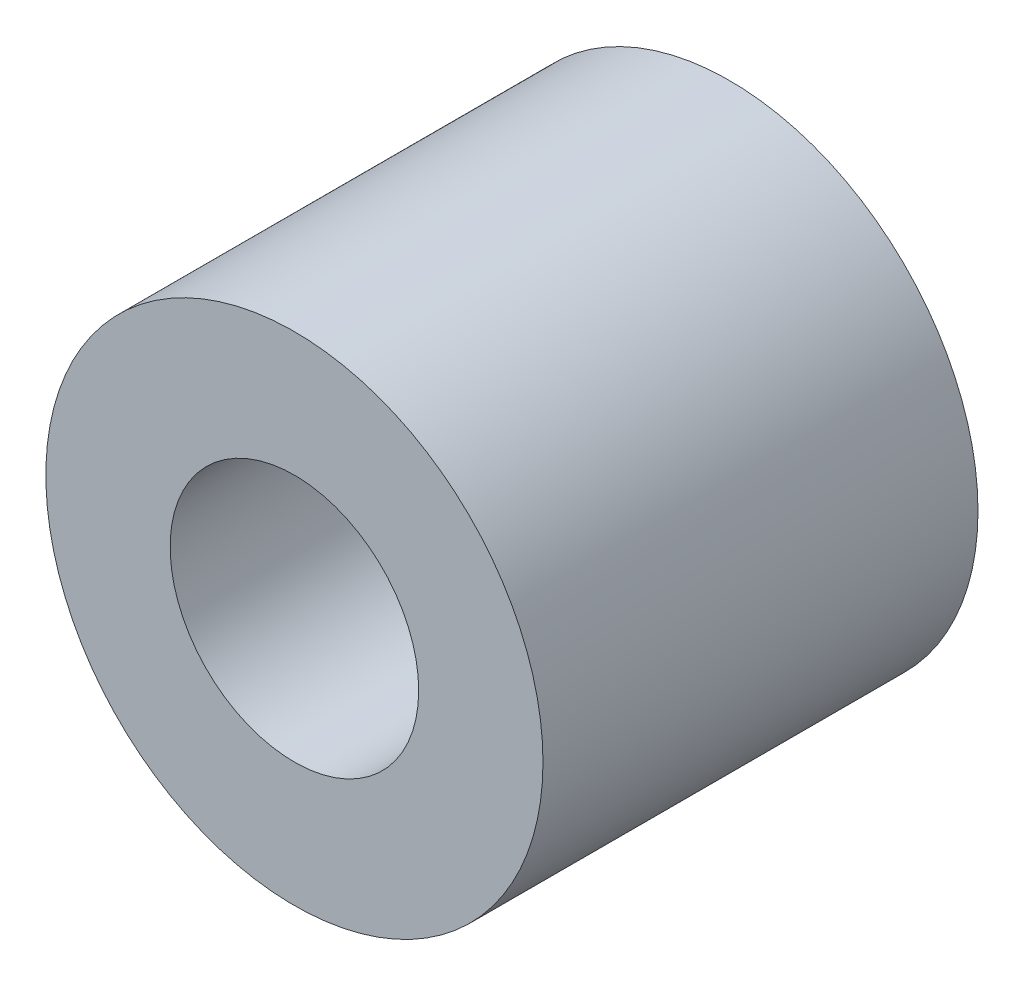
from build123d import *

# Parameters (mm, degrees)
SKETCH1_R           = 6.35
SKETCH1_R_2         = 3.175
BOSS_EXTRUDE1_DEPTH = 11.1125


with BuildPart() as part:
    # Sketch1 → Boss-Extrude1 (new body)
    with BuildSketch(Plane.XY):
        Circle(SKETCH1_R)
        Circle(SKETCH1_R_2, mode=Mode.SUBTRACT)
    extrude(amount=-BOSS_EXTRUDE1_DEPTH)


solid = part.part
